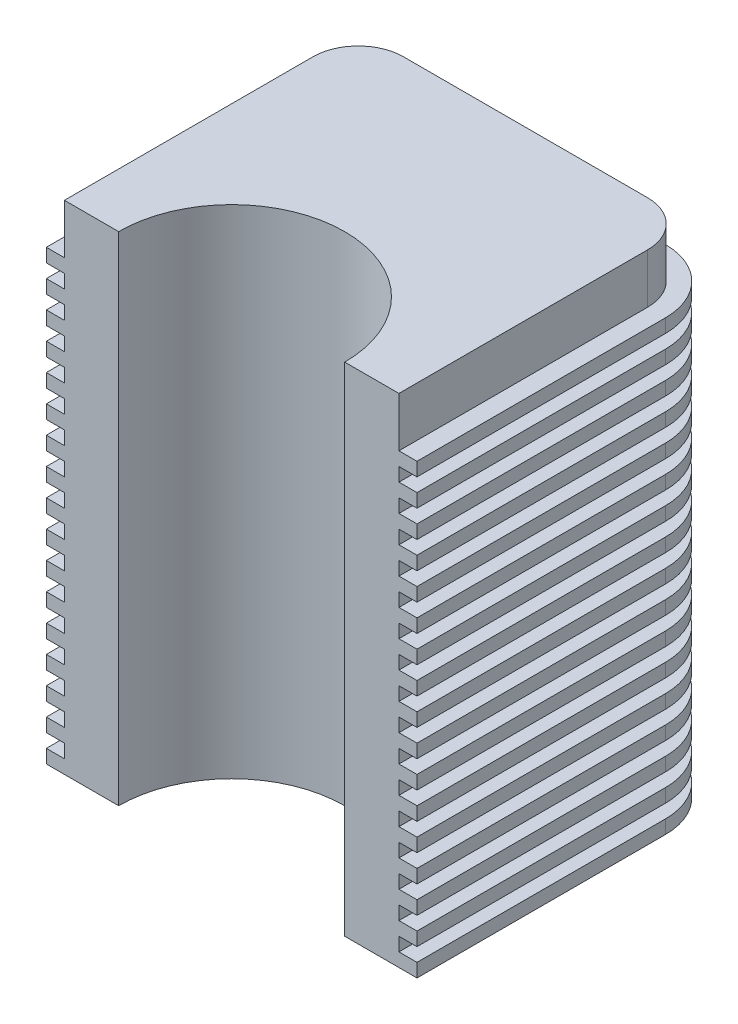
from build123d import *

# Parameters (mm, degrees)
BOSS_EXTRUDE1_DEPTH = 110
BOSS_EXTRUDE2_DEPTH = 3
LPATTERN1_COUNT     = 17
LPATTERN1_PITCH     = 6


with BuildPart() as part:
    # Sketch1 → Boss-Extrude1 (new body)
    with BuildSketch(Plane(origin=(0, 0, 0), x_dir=(1, 0, 0), z_dir=(0, 1, 0))):
        with BuildLine():
            Line((25, 0), (37, 0))
            Line((37, 0), (37, 55))
            ThreePointArc((37, 55), (34.071067812, 62.071067812), (27, 65))
            Line((27, 65), (-27, 65))
            ThreePointArc((-27, 65), (-34.071067812, 62.071067812), (-37, 55))
            Line((-37, 55), (-37, 0))
            Line((-37, 0), (-25, 0))
            ThreePointArc((-25, 0), (0, 25), (25, 0))
        make_face()
    extrude(amount=BOSS_EXTRUDE1_DEPTH)

    # Sketch2 → Boss-Extrude2 (add)
    with BuildSketch(Plane.XZ):
        with BuildLine():
            Line((-41, 0), (-41, -55))
            ThreePointArc((-41, -55), (-36.899494937, -64.899494937), (-27, -69))
            Line((-27, -69), (27, -69))
            ThreePointArc((27, -69), (36.899494937, -64.899494937), (41, -55))
            Line((41, -55), (41, 0))
            Line((41, 0), (37, 0))
            Line((37, 0), (37, -55))
            ThreePointArc((37, -55), (34.071067812, -62.071067812), (27, -65))
            Line((27, -65), (-27, -65))
            ThreePointArc((-27, -65), (-34.071067812, -62.071067812), (-37, -55))
            Line((-37, -55), (-37, 0))
            Line((-37, 0), (-41, 0))
        make_face()
    boss_extrude2 = extrude(amount=-BOSS_EXTRUDE2_DEPTH)

    # LPattern1: Boss-Extrude2 ×17
    with Locations(*[(0, i * LPATTERN1_PITCH, 0) for i in range(1, LPATTERN1_COUNT)]):
        add(boss_extrude2)


solid = part.part
